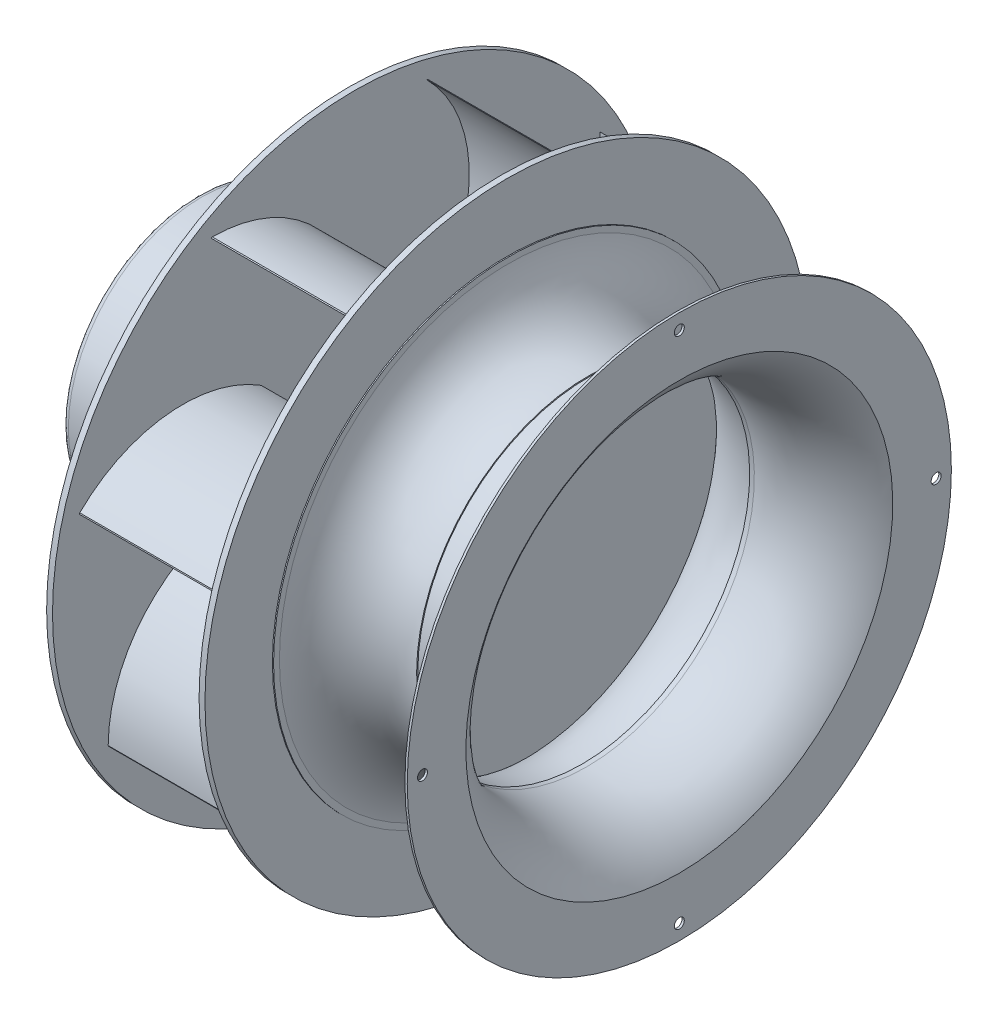
from build123d import *

# Parameters (mm, degrees)
SKETCH2_R         = 257.5
EXTRUDE1_DEPTH    = 5
SKETCH9_R         = 252.5
SKETCH9_R_2       = 100
EXTRUDE7_DEPTH    = 3
SKETCH3_R         = 257.5
EXTRUDE2_DEPTH    = 5
EXTRUDE3_DEPTH    = 130
CIRPATTERN1_COUNT = 8
SKETCH7_R         = 4.25
EXTRUDE5_DEPTH    = 5
CIRPATTERN2_COUNT = 4
SKETCH8_R         = 5
EXTRUDE6_DEPTH    = 90
CIRPATTERN3_COUNT = 8


with BuildPart() as part:
    # Sketch1 → Revolve1 (revolve)
    with BuildSketch(Plane.XY, mode=Mode.PRIVATE) as revolve1_sk:
        with BuildLine():
            Line((0, 0), (0, 109))
            ThreePointArc((0, 109), (1.464466094, 112.535533906), (5, 114))
            Line((5, 114), (70, 114))
            Line((70, 114), (70, 138))
            Line((70, 138), (90, 138))
            Line((90, 138), (90, 98))
            Line((90, 98), (95, 98))
            Line((95, 98), (95, 133))
            Line((95, 133), (105, 133))
            Line((105, 133), (105, 98))
            Line((105, 98), (130, 98))
            Line((130, 98), (130, 0))
            Line((130, 0), (0, 0))
        make_face()
    revolve(revolve1_sk.sketch.rotate(Axis((0, 0, 0), (1, 0, 0)), 90), axis=Axis((0, 0, 0), (1, 0, 0)))

    # Sketch2 → Extrude1 (add)
    with BuildSketch(Plane(origin=(130, 0, 0), x_dir=(0, 0, -1), z_dir=(1, 0, 0))):
        Circle(SKETCH2_R)
    extrude(amount=EXTRUDE1_DEPTH)

    # Sketch9 → Extrude7 (cut)
    with BuildSketch(Plane.ZY.offset(-130)):
        Circle(SKETCH9_R)
        Circle(SKETCH9_R_2, mode=Mode.SUBTRACT)
    extrude(amount=-EXTRUDE7_DEPTH, mode=Mode.SUBTRACT)



with BuildPart() as body_2:
    # Sketch3 → Extrude2 (new body)
    with BuildSketch(Plane(origin=(260, 0, 0), x_dir=(0, 0, -1), z_dir=(1, 0, 0))):
        Circle(SKETCH3_R)
    extrude(amount=EXTRUDE2_DEPTH)


with BuildPart() as part_1:
    add(part.part)

    add(body_2.part)  # Extrude3 merges body 2
    # Sketch4 → Extrude3 (add)
    with BuildSketch(Plane(origin=(135, 0, 0), x_dir=(0, 0, -1), z_dir=(1, 0, 0))):
        with BuildLine():
            Line((-121.25, 210.011160418), (-122.116025404, 209.511160418))
            ThreePointArc((-122.116025404, 209.511160418), (-44.469436379, 181.921031018), (-0.866025404, 112))
            Line((-0.866025404, 112), (0, 112.5))
            ThreePointArc((0, 112.5), (-43.603410976, 182.421031018), (-121.25, 210.011160418))
        make_face()
    extrude3 = extrude(amount=EXTRUDE3_DEPTH)

    # CirPattern1: Extrude3 ×8 about axis
    cirpattern1_axis = Axis((0, 0, 0), (1, 0, 0))
    for i in range(1, CIRPATTERN1_COUNT):
        add(extrude3.rotate(cirpattern1_axis, i * 360 / CIRPATTERN1_COUNT))

    # Sketch5 → Revolve2 (revolve)
    with BuildSketch(Plane.XY, mode=Mode.PRIVATE) as revolve2_sk:
        with BuildLine():
            Line((265, 200), (266, 200))
            Line((266, 200), (266, 195))
            ThreePointArc((266, 195), (290.025762909, 156.658201589), (334, 146))
            Line((334, 146), (334, 145))
            ThreePointArc((334, 145), (289.082569219, 155.623945523), (265, 195))
            Line((265, 195), (265, 200))
        make_face()
    revolve(revolve2_sk.sketch.rotate(Axis((0, 0, 0), (1, 0, 0)), 90), axis=Axis((0, 0, 0), (1, 0, 0)))

    # Sketch8 → Extrude6 (cut)
    with BuildSketch(Plane(origin=(0, 0, 0), x_dir=(0, 0, -1), z_dir=(1, 0, 0))):
        with Locations(Location((0, 126, 0), (0, 0, 180))):
            Circle(SKETCH8_R)
    extrude6 = extrude(amount=EXTRUDE6_DEPTH, mode=Mode.SUBTRACT)

    # CirPattern3: Extrude6 ×8 about axis
    cirpattern3_axis = Axis((0, 0, 0), (1, 0, 0))
    for i in range(1, CIRPATTERN3_COUNT):
        add(extrude6.rotate(cirpattern3_axis, i * 360 / CIRPATTERN3_COUNT), mode=Mode.SUBTRACT)


with BuildPart() as body_2_2:
    # Sketch6 → Revolve3 (revolve)
    with BuildSketch(Plane.XY, mode=Mode.PRIVATE) as revolve3_sk:
        with BuildLine():
            Line((412, 232), (410, 232))
            Line((410, 232), (410, 182))
            ThreePointArc((410, 182), (376.85220133, 152.361635071), (333, 145))
            Line((333, 145), (329, 145))
            Line((329, 145), (329, 143))
            Line((329, 143), (333, 143))
            ThreePointArc((333, 143), (378.352293074, 150.645355054), (412, 182))
            Line((412, 182), (412, 232))
        make_face()
    revolve(revolve3_sk.sketch.rotate(Axis((0, 0, 0), (1, 0, 0)), 180), axis=Axis((0, 0, 0), (1, 0, 0)))

    # Sketch7 → Extrude5 (cut)
    with BuildSketch(Plane(origin=(412, 0, 0), x_dir=(0, 0, -1), z_dir=(1, 0, 0))):
        with Locations((0, 219)):
            Circle(SKETCH7_R)
    extrude5 = extrude(amount=-EXTRUDE5_DEPTH, mode=Mode.SUBTRACT)

    # CirPattern2: Extrude5 ×4 about axis
    cirpattern2_axis = Axis((0, 0, 0), (1, 0, 0))
    for i in range(1, CIRPATTERN2_COUNT):
        add(extrude5.rotate(cirpattern2_axis, i * 360 / CIRPATTERN2_COUNT), mode=Mode.SUBTRACT)


solid = Compound([part_1.part, body_2_2.part])
